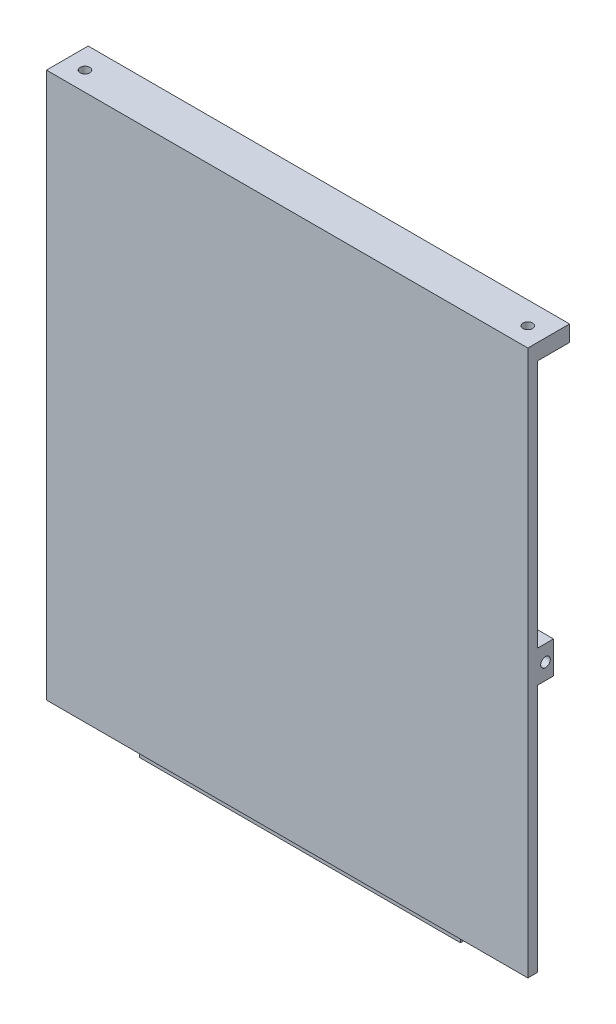
from build123d import *

# Parameters (mm, degrees)
SKETCH1_W           = 150
SKETCH1_H           = 3
BOSS_EXTRUDE1_DEPTH = 170
SKETCH2_W           = 150
SKETCH2_H           = 5
BOSS_EXTRUDE2_DEPTH = 10
SKETCH3_W           = 100
SKETCH3_H           = 3
BOSS_EXTRUDE3_DEPTH = 3
SKETCH4_W           = 100
SKETCH4_H           = 3
BOSS_EXTRUDE4_DEPTH = 5
SKETCH5_R           = 1.5
CUT_EXTRUDE1_DEPTH  = 191.741316971
SKETCH6_W           = 8
SKETCH6_H           = 10
BOSS_EXTRUDE5_DEPTH = 5
SKETCH8_W           = 8
SKETCH8_H           = 10
BOSS_EXTRUDE6_DEPTH = 5
SKETCH9_R           = 1.5
CUT_EXTRUDE2_DEPTH  = 228.007158477
SKETCH10_W          = 100
SKETCH10_H          = 5
CUT_EXTRUDE3_DEPTH  = 1


with BuildPart() as part:
    # Sketch1 → Boss-Extrude1 (new body)
    with BuildSketch(Plane(origin=(0, 0, 0), x_dir=(1, 0, 0), z_dir=(0, 1, 0))):
        Rectangle(SKETCH1_W, SKETCH1_H)
    extrude(amount=BOSS_EXTRUDE1_DEPTH)

    # Sketch2 → Boss-Extrude2 (add)
    with BuildSketch(Plane(origin=(0, 0, -1.5), x_dir=(-1, 0, 0), z_dir=(0, 0, -1))):
        with Locations((0, 167.5)):
            Rectangle(SKETCH2_W, SKETCH2_H)
    extrude(amount=BOSS_EXTRUDE2_DEPTH)

    # Sketch3 → Boss-Extrude3 (add)
    with BuildSketch(Plane(origin=(0, 0, -1.5), x_dir=(-1, 0, 0), z_dir=(0, 0, -1))):
        with Locations((0, 1.5)):
            Rectangle(SKETCH3_W, SKETCH3_H)
    extrude(amount=BOSS_EXTRUDE3_DEPTH)

    # Sketch4 → Boss-Extrude4 (add)
    with BuildSketch(Plane.XZ):
        with Locations((0, -3)):
            Rectangle(SKETCH4_W, SKETCH4_H)
    extrude(amount=BOSS_EXTRUDE4_DEPTH)

    # Sketch5 → Cut-Extrude1 (cut, through all)
    with BuildSketch(Plane(origin=(0, 170, 0), x_dir=(1, 0, 0), z_dir=(0, 1, 0))):
        with Locations(Location((69, 4.5, 0), (0, 0, 270))):
            Circle(SKETCH5_R)
        with Locations(Location((-69, 4.5, 0), (0, 0, 270))):
            Circle(SKETCH5_R)
    extrude(amount=-CUT_EXTRUDE1_DEPTH, mode=Mode.SUBTRACT)

    # Sketch6 → Boss-Extrude5 (add)
    with BuildSketch(Plane(origin=(75, 0, 0), x_dir=(0, 0, -1), z_dir=(1, 0, 0))):
        with Locations((2.5, 82.5)):
            Rectangle(SKETCH6_W, SKETCH6_H)
    extrude(amount=-BOSS_EXTRUDE5_DEPTH)

    # Sketch8 → Boss-Extrude6 (add)
    with BuildSketch(Plane.ZY.offset(75)):
        with Locations((-2.5, 82.5)):
            Rectangle(SKETCH8_W, SKETCH8_H)
    extrude(amount=-BOSS_EXTRUDE6_DEPTH)

    # Sketch9 → Cut-Extrude2 (cut, through all)
    with BuildSketch(Plane.ZY.offset(75)):
        with Locations((-4, 82.5)):
            Circle(SKETCH9_R)
    extrude(amount=-CUT_EXTRUDE2_DEPTH, mode=Mode.SUBTRACT)

    # Sketch10 → Cut-Extrude3 (cut)
    with BuildSketch(Plane.XY.offset(-1.5)):
        with Locations((0, -2.5)):
            Rectangle(SKETCH10_W, SKETCH10_H)
    extrude(amount=-CUT_EXTRUDE3_DEPTH, mode=Mode.SUBTRACT)


solid = part.part
